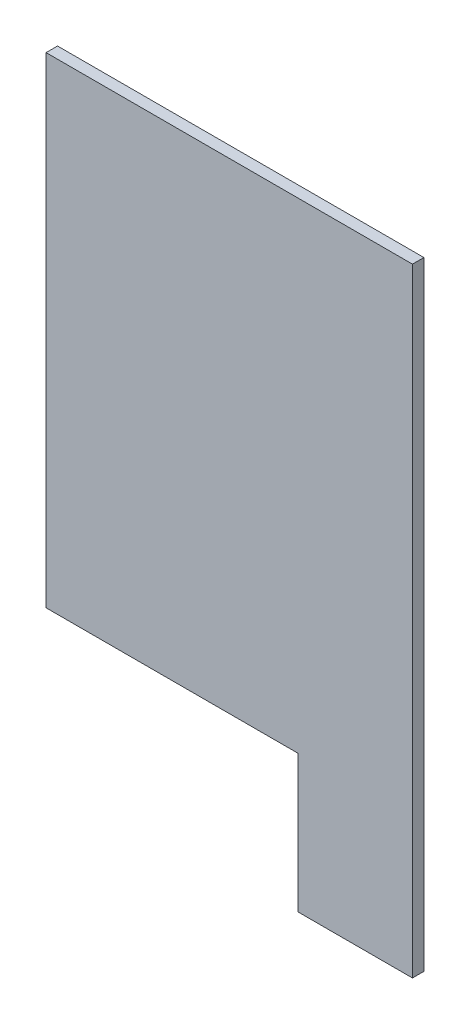
from build123d import *

# Parameters (mm, degrees)
BOSS_EXTRUDE1_DEPTH = 5


with BuildPart() as part:
    # Sketch1 → Boss-Extrude1 (new body)
    with BuildSketch(Plane.XY):
        Polygon((0, -210), (110, -210), (110, -270), (160, -270), (160, 0), (0, 0), align=None)
    extrude(amount=BOSS_EXTRUDE1_DEPTH)


solid = part.part
